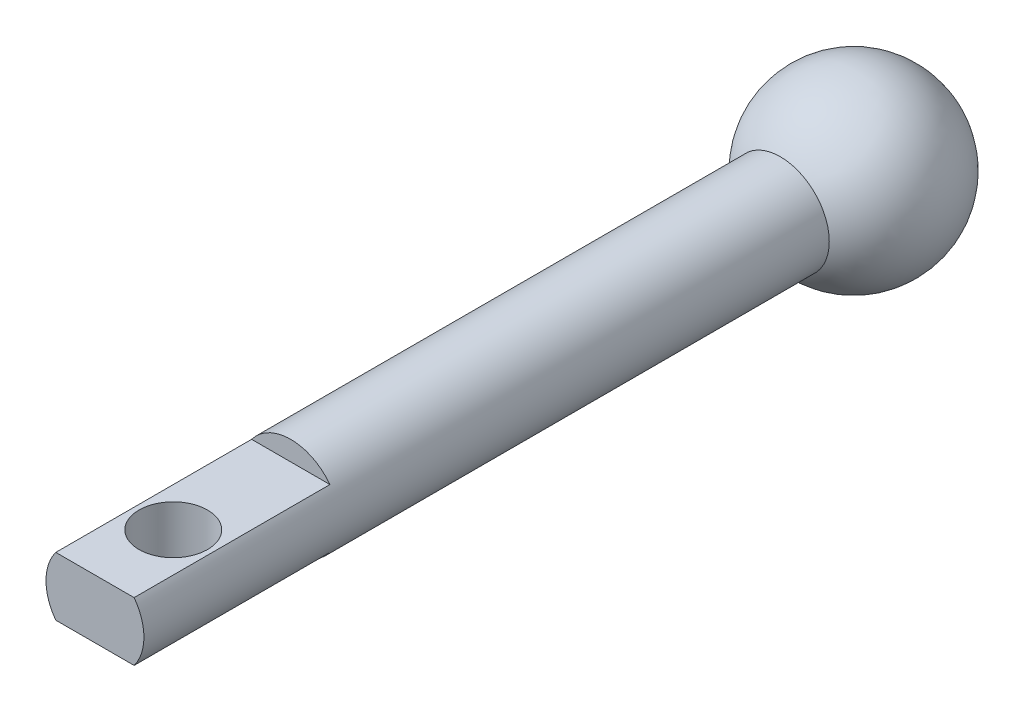
from build123d import *

# Parameters (mm, degrees)
CUT_EXTRUDE3_START      = -10
CUT_EXTRUDE3_DEPTH      = 10
CUT_EXTRUDE4_DEPTH      = 44.707447118
CUT_EXTRUDE4_DEPTH_BACK = 44.707447118
SKETCH4_R               = 1.75


with BuildPart() as part:
    # Sketch1 → Revolve1 (revolve)
    with BuildSketch(Plane(origin=(0, 0, 0), x_dir=(1, 0, 0), z_dir=(0, 1, 0)), mode=Mode.PRIVATE) as revolve1_sk:
        with BuildLine():
            Line((0, 43.241657387), (0, 0))
            Line((0, 0), (2.5, 0))
            Line((2.5, 0), (2.5, 35))
            ThreePointArc((2.5, 35), (4.30624304, 40.047900427), (0, 43.241657387))
        make_face()
    revolve(revolve1_sk.sketch.rotate(Axis((0, 0, -43.241657387), (0, 0, 1)), 180), axis=Axis((0, 0, -43.241657387), (0, 0, 1)))

    # Sketch2 → Cut-Extrude3 (cut)
    with BuildSketch(Plane.XY.offset(CUT_EXTRUDE3_START)):
        with BuildLine():
            ThreePointArc((2, 1.5), (0, 2.5), (-2, 1.5))
            Line((-2, 1.5), (2, 1.5))
        make_face()
        with BuildLine():
            Line((2, -1.5), (-2, -1.5))
            ThreePointArc((-2, -1.5), (0, -2.5), (2, -1.5))
        make_face()
    extrude(amount=CUT_EXTRUDE3_DEPTH, mode=Mode.SUBTRACT)

    # Sketch4 → Cut-Extrude4 (cut, two sides: drawn at the far end of the back side and taken through both)
    with BuildSketch(Plane(origin=(0, 0, 0), x_dir=(1, 0, 0), z_dir=(0, 1, 0)).offset(-CUT_EXTRUDE4_DEPTH_BACK)):
        with Locations(Location((0, 4, 0), (0, 0, 90))):
            Circle(SKETCH4_R)
    extrude(amount=CUT_EXTRUDE4_DEPTH + CUT_EXTRUDE4_DEPTH_BACK, mode=Mode.SUBTRACT)


solid = part.part
